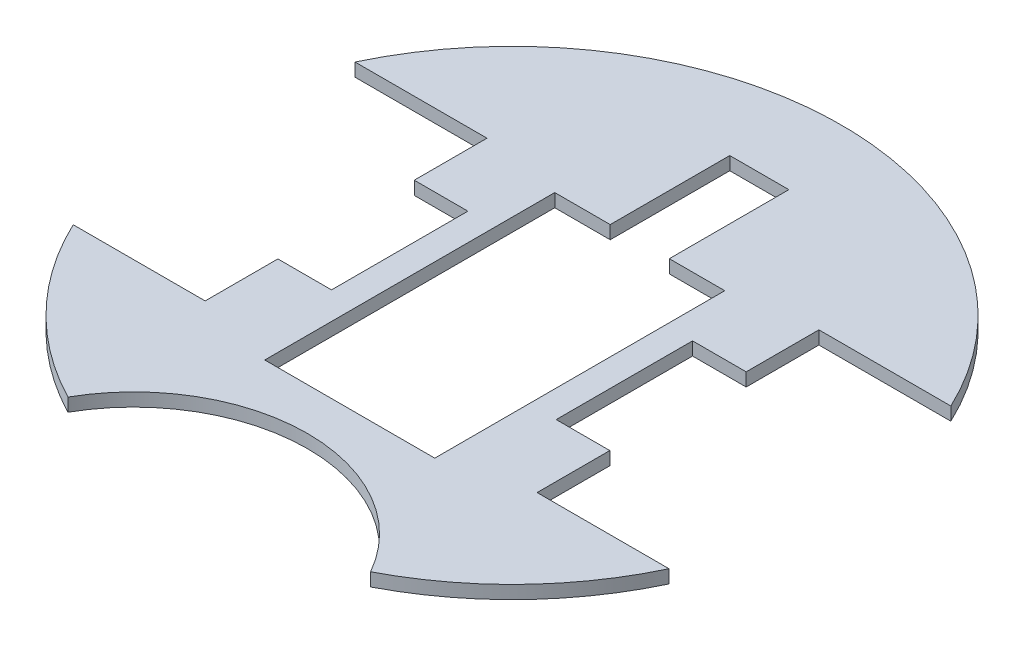
from build123d import *

# Parameters (mm, degrees)
BOSS_EXTRUDE1_DEPTH  = 2.9
SOLENOID_PLACEMENT_W = 37.4
SOLENOID_PLACEMENT_H = 63.8
CUT_EXTRUDE1_DEPTH   = 103.571487266
CUT_EXTRUDE3_DEPTH   = 103.571487266
SKETCH4_W            = 13
SKETCH4_H            = 26.3
CUT_EXTRUDE4_DEPTH   = 98.774792252


with BuildPart() as part:
    # Sketch1 → Boss-Extrude1 (new body)
    with BuildSketch(Plane(origin=(0, 0, 0), x_dir=(1, 0, 0), z_dir=(0, 1, 0))):
        with BuildLine():
            ThreePointArc((33.29110537, -64.404598464), (0, 72.5), (-33.29110537, -64.404598464))
            ThreePointArc((-33.29110537, -64.404598464), (0, -44.989799638), (33.29110537, -64.404598464))
        make_face()
    extrude(amount=BOSS_EXTRUDE1_DEPTH)

    # solenoid placement → Cut-Extrude1 (cut, through all)
    with BuildSketch(Plane(origin=(0, 2.9, 0), x_dir=(1, 0, 0), z_dir=(0, 1, 0))):
        with Locations((0, -3.8)):
            Rectangle(SOLENOID_PLACEMENT_W, SOLENOID_PLACEMENT_H)
    extrude(amount=-CUT_EXTRUDE1_DEPTH, mode=Mode.SUBTRACT)

    # Sketch3 → Cut-Extrude3 (cut, through all)
    with BuildSketch(Plane(origin=(0, 2.9, 0), x_dir=(1, 0, 0), z_dir=(0, 1, 0))):
        with BuildLine():
            Line((-36.51, -15), (-36.51, -31))
            Line((-36.51, -31), (-65.538156825, -31))
            ThreePointArc((-65.538156825, -31), (-72.5, 0), (-65.538156825, 31))
            Line((-65.538156825, 31), (-36.51, 31))
            Line((-36.51, 31), (-36.51, 15))
            Line((-36.51, 15), (-24.71, 15))
            Line((-24.71, 15), (-24.71, -15))
            Line((-24.71, -15), (-36.51, -15))
        make_face()
        with BuildLine():
            Line((36.51, 31), (65.538156825, 31))
            ThreePointArc((65.538156825, 31), (72.5, 0), (65.538156825, -31))
            Line((65.538156825, -31), (36.51, -31))
            Line((36.51, -31), (36.51, -15))
            Line((36.51, -15), (24.71, -15))
            Line((24.71, -15), (24.71, 15))
            Line((24.71, 15), (36.51, 15))
            Line((36.51, 15), (36.51, 31))
        make_face()
    extrude(amount=-CUT_EXTRUDE3_DEPTH, mode=Mode.SUBTRACT)

    # Sketch4 → Cut-Extrude4 (cut, through all)
    with BuildSketch(Plane(origin=(0, 2.9, 0), x_dir=(1, 0, 0), z_dir=(0, 1, 0))):
        with Locations((0, 41.25)):
            Rectangle(SKETCH4_W, SKETCH4_H)
    extrude(amount=-CUT_EXTRUDE4_DEPTH, mode=Mode.SUBTRACT)


solid = part.part
